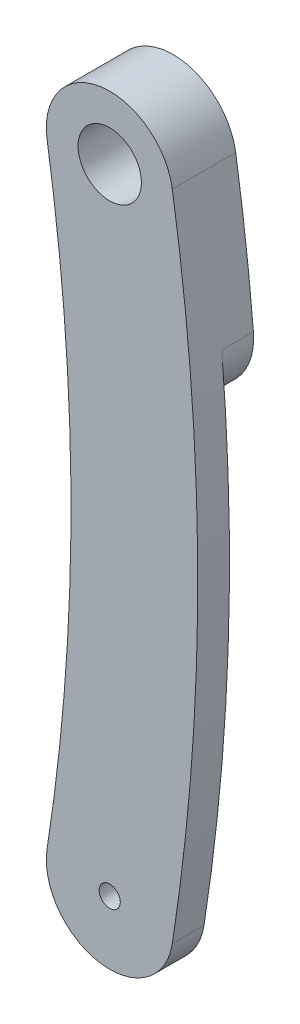
from build123d import *
from build123d.topology import SkipClean

# Parameters (mm, degrees)
SKETCH1_R           = 1.5
SKETCH1_R_2         = 0.5
BOSS_EXTRUDE1_DEPTH = 1.5
BOSS_EXTRUDE2_START = 1.5
SKETCH2_R           = 1.5
BOSS_EXTRUDE2_DEPTH = 1.5


with BuildPart() as part:
    # Sketch1 → Boss-Extrude1 (new body)
    with BuildSketch(Plane.XY):
        with BuildLine():
            ThreePointArc((2.963913043, 15.463917526), (4.166811594, 0), (2.963913043, -15.463917526))
            ThreePointArc((2.963913043, -15.463917526), (-0.463917526, -17.963913043), (-2.963913043, -14.536082474))
            ThreePointArc((-2.963913043, -14.536082474), (-1.833188406, 0), (-2.963913043, 14.536082474))
            ThreePointArc((-2.963913043, 14.536082474), (-0.463917526, 17.963913043), (2.963913043, 15.463917526))
        make_face()
        with Locations((0, 15)):
            Circle(SKETCH1_R, mode=Mode.SUBTRACT)
        with Locations((0, -15)):
            Circle(SKETCH1_R_2, mode=Mode.SUBTRACT)
    extrude(amount=BOSS_EXTRUDE1_DEPTH)

    # Sketch2 → Boss-Extrude2 (add)
    with SkipClean():  # the faces are left unmerged after this step: merging them gives an invalid solid
        with BuildSketch(Plane(origin=(0, 0, 0), x_dir=(-1, 0, 0), z_dir=(0, 0, -1)).offset(BOSS_EXTRUDE2_START)):
            with BuildLine():
                ThreePointArc((-2.963913043, 15.463917526), (-3.443316756, 12.007311225), (-3.801821987, 8.536082474))
                ThreePointArc((-3.801821987, 8.536082474), (-1.06885415, 5.290949688), (2.176278636, 8.023917526))
                ThreePointArc((2.176278636, 8.023917526), (2.513273554, 11.286872551), (2.963913043, 14.536082474))
                ThreePointArc((2.963913043, 14.536082474), (0.463917526, 17.963913043), (-2.963913043, 15.463917526))
            make_face()
            with Locations((0, 15)):
                Circle(SKETCH2_R, mode=Mode.SUBTRACT)
        extrude(amount=-BOSS_EXTRUDE2_DEPTH)


solid = part.part
